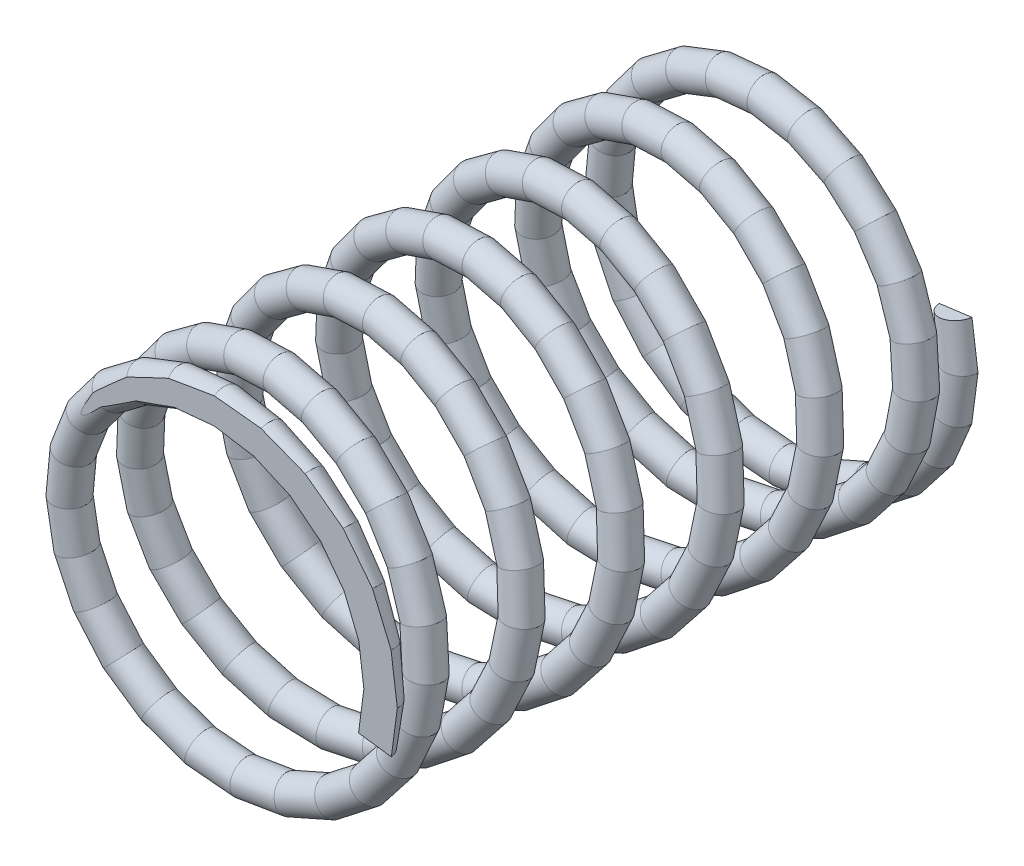
from build123d import *

# Parameters (mm, degrees)
SWEEP_4_PROFILE_R   = 2
SKETCH_8_W          = 100
SKETCH_8_H          = 100
CUT_EXTRUDE_3_DEPTH = 10
SKETCH_9_W          = 100
SKETCH_9_H          = 100
CUT_EXTRUDE_4_DEPTH = 10


with BuildPart() as part:
    # 扫描4: sweep along a curve in space
    with BuildLine() as sweep_4_path:
        Line((19.3185, 5.1764, -0.2083), (20, 0, 0))
        Line((20, 0, 0), (19.3185, -5.1764, 0.2083))
        Line((19.3185, -5.1764, 0.2083), (17.3205, -10, 0.4167))
        Line((17.3205, -10, 0.4167), (14.1421, -14.1421, 0.625))
        Line((14.1421, -14.1421, 0.625), (10, -17.3205, 0.8333))
        Line((10, -17.3205, 0.8333), (5.1764, -19.3185, 1.0417))
        Line((5.1764, -19.3185, 1.0417), (0, -20, 1.25))
        Line((0, -20, 1.25), (-5.1764, -19.3185, 1.4583))
        Line((-5.1764, -19.3185, 1.4583), (-10, -17.3205, 1.6667))
        Line((-10, -17.3205, 1.6667), (-14.1421, -14.1421, 1.875))
        Line((-14.1421, -14.1421, 1.875), (-17.3205, -10, 2.0833))
        Line((-17.3205, -10, 2.0833), (-19.3185, -5.1764, 2.2917))
        Line((-19.3185, -5.1764, 2.2917), (-20, 0, 2.5))
        Line((-20, 0, 2.5), (-19.3185, 5.1764, 2.7083))
        Line((-19.3185, 5.1764, 2.7083), (-17.3205, 10, 2.9167))
        Line((-17.3205, 10, 2.9167), (-14.1421, 14.1421, 3.125))
        Line((-14.1421, 14.1421, 3.125), (-10, 17.3205, 3.3333))
        Line((-10, 17.3205, 3.3333), (-5.1764, 19.3185, 3.5417))
        Line((-5.1764, 19.3185, 3.5417), (0, 20, 3.75))
        Line((0, 20, 3.75), (5.1764, 19.3185, 3.9705))
        Line((5.1764, 19.3185, 3.9705), (10, 17.3205, 4.2153))
        Line((10, 17.3205, 4.2153), (14.1421, 14.1421, 4.4844))
        Line((14.1421, 14.1421, 4.4844), (17.3205, 10, 4.7778))
        Line((17.3205, 10, 4.7778), (19.3185, 5.1764, 5.0955))
        Line((19.3185, 5.1764, 5.0955), (20, 0, 5.4375))
        Line((20, 0, 5.4375), (19.3185, -5.1764, 5.803))
        Line((19.3185, -5.1764, 5.803), (17.3205, -10, 6.1944))
        Line((17.3205, -10, 6.1944), (14.1421, -14.1421, 6.6094))
        Line((14.1421, -14.1421, 6.6094), (10, -17.3205, 7.0486))
        Line((10, -17.3205, 7.0486), (5.1764, -19.3185, 7.5122))
        Line((5.1764, -19.3185, 7.5122), (0, -20, 8))
        Line((0, -20, 8), (-5.1764, -19.3185, 8.5))
        Line((-5.1764, -19.3185, 8.5), (-10, -17.3205, 9))
        Line((-10, -17.3205, 9), (-14.1421, -14.1421, 9.5))
        Line((-14.1421, -14.1421, 9.5), (-17.3205, -10, 10))
        Line((-17.3205, -10, 10), (-19.3185, -5.1764, 10.5))
        Line((-19.3185, -5.1764, 10.5), (-20, 0, 11))
        Line((-20, 0, 11), (-19.3185, 5.1764, 11.5))
        Line((-19.3185, 5.1764, 11.5), (-17.3205, 10, 12))
        Line((-17.3205, 10, 12), (-14.1421, 14.1421, 12.5))
        Line((-14.1421, 14.1421, 12.5), (-10, 17.3205, 13))
        Line((-10, 17.3205, 13), (-5.1764, 19.3185, 13.5))
        Line((-5.1764, 19.3185, 13.5), (0, 20, 14))
        Line((0, 20, 14), (5.1764, 19.3185, 14.5))
        Line((5.1764, 19.3185, 14.5), (10, 17.3205, 15))
        Line((10, 17.3205, 15), (14.1421, 14.1421, 15.5))
        Line((14.1421, 14.1421, 15.5), (17.3205, 10, 16))
        Line((17.3205, 10, 16), (19.3185, 5.1764, 16.5))
        Line((19.3185, 5.1764, 16.5), (20, 0, 17))
        Line((20, 0, 17), (19.3185, -5.1764, 17.5))
        Line((19.3185, -5.1764, 17.5), (17.3205, -10, 18))
        Line((17.3205, -10, 18), (14.1421, -14.1421, 18.5))
        Line((14.1421, -14.1421, 18.5), (10, -17.3205, 19))
        Line((10, -17.3205, 19), (5.1764, -19.3185, 19.5))
        Line((5.1764, -19.3185, 19.5), (0, -20, 20))
        Line((0, -20, 20), (-5.1764, -19.3185, 20.5))
        Line((-5.1764, -19.3185, 20.5), (-10, -17.3205, 21))
        Line((-10, -17.3205, 21), (-14.1421, -14.1421, 21.5))
        Line((-14.1421, -14.1421, 21.5), (-17.3205, -10, 22))
        Line((-17.3205, -10, 22), (-19.3185, -5.1764, 22.5))
        Line((-19.3185, -5.1764, 22.5), (-20, 0, 23))
        Line((-20, 0, 23), (-19.3185, 5.1764, 23.5))
        Line((-19.3185, 5.1764, 23.5), (-17.3205, 10, 24))
        Line((-17.3205, 10, 24), (-14.1421, 14.1421, 24.5))
        Line((-14.1421, 14.1421, 24.5), (-10, 17.3205, 25))
        Line((-10, 17.3205, 25), (-5.1764, 19.3185, 25.5))
        Line((-5.1764, 19.3185, 25.5), (0, 20, 26))
        Line((0, 20, 26), (5.1764, 19.3185, 26.5))
        Line((5.1764, 19.3185, 26.5), (10, 17.3205, 27))
        Line((10, 17.3205, 27), (14.1421, 14.1421, 27.5))
        Line((14.1421, 14.1421, 27.5), (17.3205, 10, 28))
        Line((17.3205, 10, 28), (19.3185, 5.1764, 28.5))
        Line((19.3185, 5.1764, 28.5), (20, 0, 29))
        Line((20, 0, 29), (19.3185, -5.1764, 29.5))
        Line((19.3185, -5.1764, 29.5), (17.3205, -10, 30))
        Line((17.3205, -10, 30), (14.1421, -14.1421, 30.5))
        Line((14.1421, -14.1421, 30.5), (10, -17.3205, 31))
        Line((10, -17.3205, 31), (5.1764, -19.3185, 31.5))
        Line((5.1764, -19.3185, 31.5), (0, -20, 32))
        Line((0, -20, 32), (-5.1764, -19.3185, 32.5))
        Line((-5.1764, -19.3185, 32.5), (-10, -17.3205, 33))
        Line((-10, -17.3205, 33), (-14.1421, -14.1421, 33.5))
        Line((-14.1421, -14.1421, 33.5), (-17.3205, -10, 34))
        Line((-17.3205, -10, 34), (-19.3185, -5.1764, 34.5))
        Line((-19.3185, -5.1764, 34.5), (-20, 0, 35))
        Line((-20, 0, 35), (-19.3185, 5.1764, 35.5))
        Line((-19.3185, 5.1764, 35.5), (-17.3205, 10, 36))
        Line((-17.3205, 10, 36), (-14.1421, 14.1421, 36.5))
        Line((-14.1421, 14.1421, 36.5), (-10, 17.3205, 37))
        Line((-10, 17.3205, 37), (-5.1764, 19.3185, 37.5))
        Line((-5.1764, 19.3185, 37.5), (0, 20, 38))
        Line((0, 20, 38), (5.1764, 19.3185, 38.5))
        Line((5.1764, 19.3185, 38.5), (10, 17.3205, 39))
        Line((10, 17.3205, 39), (14.1421, 14.1421, 39.5))
        Line((14.1421, 14.1421, 39.5), (17.3205, 10, 40))
        Line((17.3205, 10, 40), (19.3185, 5.1764, 40.5))
        Line((19.3185, 5.1764, 40.5), (20, 0, 41))
        Line((20, 0, 41), (19.3185, -5.1764, 41.5))
        Line((19.3185, -5.1764, 41.5), (17.3205, -10, 42))
        Line((17.3205, -10, 42), (14.1421, -14.1421, 42.5))
        Line((14.1421, -14.1421, 42.5), (10, -17.3205, 43))
        Line((10, -17.3205, 43), (5.1764, -19.3185, 43.5))
        Line((5.1764, -19.3185, 43.5), (0, -20, 44))
        Line((0, -20, 44), (-5.1764, -19.3185, 44.5))
        Line((-5.1764, -19.3185, 44.5), (-10, -17.3205, 45))
        Line((-10, -17.3205, 45), (-14.1421, -14.1421, 45.5))
        Line((-14.1421, -14.1421, 45.5), (-17.3205, -10, 46))
        Line((-17.3205, -10, 46), (-19.3185, -5.1764, 46.5))
        Line((-19.3185, -5.1764, 46.5), (-20, 0, 47))
        Line((-20, 0, 47), (-19.3185, 5.1764, 47.5))
        Line((-19.3185, 5.1764, 47.5), (-17.3205, 10, 48))
        Line((-17.3205, 10, 48), (-14.1421, 14.1421, 48.5))
        Line((-14.1421, 14.1421, 48.5), (-10, 17.3205, 49))
        Line((-10, 17.3205, 49), (-5.1764, 19.3185, 49.5))
        Line((-5.1764, 19.3185, 49.5), (0, 20, 50))
        Line((0, 20, 50), (5.1764, 19.3185, 50.5))
        Line((5.1764, 19.3185, 50.5), (10, 17.3205, 51))
        Line((10, 17.3205, 51), (14.1421, 14.1421, 51.5))
        Line((14.1421, 14.1421, 51.5), (17.3205, 10, 52))
        Line((17.3205, 10, 52), (19.3185, 5.1764, 52.5))
        Line((19.3185, 5.1764, 52.5), (20, 0, 53))
        Line((20, 0, 53), (19.3185, -5.1764, 53.5))
        Line((19.3185, -5.1764, 53.5), (17.3205, -10, 54))
        Line((17.3205, -10, 54), (14.1421, -14.1421, 54.5))
        Line((14.1421, -14.1421, 54.5), (10, -17.3205, 55))
        Line((10, -17.3205, 55), (5.1764, -19.3185, 55.5))
        Line((5.1764, -19.3185, 55.5), (0, -20, 56))
        Line((0, -20, 56), (-5.1764, -19.3185, 56.5))
        Line((-5.1764, -19.3185, 56.5), (-10, -17.3205, 57))
        Line((-10, -17.3205, 57), (-14.1421, -14.1421, 57.5))
        Line((-14.1421, -14.1421, 57.5), (-17.3205, -10, 58))
        Line((-17.3205, -10, 58), (-19.3185, -5.1764, 58.5))
        Line((-19.3185, -5.1764, 58.5), (-20, 0, 59))
        Line((-20, 0, 59), (-19.3185, 5.1764, 59.5))
        Line((-19.3185, 5.1764, 59.5), (-17.3205, 10, 60))
        Line((-17.3205, 10, 60), (-14.1421, 14.1421, 60.5))
        Line((-14.1421, 14.1421, 60.5), (-10, 17.3205, 61))
        Line((-10, 17.3205, 61), (-5.1764, 19.3185, 61.5))
        Line((-5.1764, 19.3185, 61.5), (0, 20, 62))
        Line((0, 20, 62), (5.1764, 19.3185, 62.4878))
        Line((5.1764, 19.3185, 62.4878), (10, 17.3205, 62.9514))
        Line((10, 17.3205, 62.9514), (14.1421, 14.1421, 63.3906))
        Line((14.1421, 14.1421, 63.3906), (17.3205, 10, 63.8056))
        Line((17.3205, 10, 63.8056), (19.3185, 5.1764, 64.1962))
        Line((19.3185, 5.1764, 64.1962), (20, 0, 64.5625))
        Line((20, 0, 64.5625), (19.3185, -5.1764, 64.9045))
        Line((19.3185, -5.1764, 64.9045), (17.3205, -10, 65.2222))
        Line((17.3205, -10, 65.2222), (14.1421, -14.1421, 65.5156))
        Line((14.1421, -14.1421, 65.5156), (10, -17.3205, 65.7847))
        Line((10, -17.3205, 65.7847), (5.1764, -19.3185, 66.0295))
        Line((5.1764, -19.3185, 66.0295), (0, -20, 66.25))
        Line((0, -20, 66.25), (-5.1764, -19.3185, 66.4583))
        Line((-5.1764, -19.3185, 66.4583), (-10, -17.3205, 66.6667))
        Line((-10, -17.3205, 66.6667), (-14.1421, -14.1421, 66.875))
        Line((-14.1421, -14.1421, 66.875), (-17.3205, -10, 67.0833))
        Line((-17.3205, -10, 67.0833), (-19.3185, -5.1764, 67.2917))
        Line((-19.3185, -5.1764, 67.2917), (-20, 0, 67.5))
        Line((-20, 0, 67.5), (-19.3185, 5.1764, 67.7083))
        Line((-19.3185, 5.1764, 67.7083), (-17.3205, 10, 67.9167))
        Line((-17.3205, 10, 67.9167), (-14.1421, 14.1421, 68.125))
        Line((-14.1421, 14.1421, 68.125), (-10, 17.3205, 68.3333))
        Line((-10, 17.3205, 68.3333), (-5.1764, 19.3185, 68.5417))
        Line((-5.1764, 19.3185, 68.5417), (0, 20, 68.75))
        Line((0, 20, 68.75), (5.1764, 19.3185, 68.9583))
        Line((5.1764, 19.3185, 68.9583), (10, 17.3205, 69.1667))
        Line((10, 17.3205, 69.1667), (14.1421, 14.1421, 69.375))
        Line((14.1421, 14.1421, 69.375), (17.3205, 10, 69.5833))
        Line((17.3205, 10, 69.5833), (19.3185, 5.1764, 69.7917))
        Line((19.3185, 5.1764, 69.7917), (20, 0, 70))
        Line((20, 0, 70), (19.3185, -5.1764, 70.2083))
    # 扫描4 profile (on start of the path) → 扫描4 (sweep)
    with BuildSketch(Plane(origin=(19.3185, 5.1764, -0.2083), x_dir=(-0.9914445140812447, -0.13052883014186853, 0), z_dir=(0.1304250729783348, -0.9906564163830556, 0.03986433265060476))):
        Circle(SWEEP_4_PROFILE_R)
    sweep(path=sweep_4_path.line, transition=Transition.RIGHT)

    # 草图8 → 切除-拉伸3 (cut)
    with BuildSketch(Plane.XY):
        Rectangle(SKETCH_8_W, SKETCH_8_H)
    extrude(amount=-CUT_EXTRUDE_3_DEPTH, mode=Mode.SUBTRACT)

    # 草图9 → 切除-拉伸4 (cut)
    with BuildSketch(Plane.XY.offset(70)):
        Rectangle(SKETCH_9_W, SKETCH_9_H)
    extrude(amount=CUT_EXTRUDE_4_DEPTH, mode=Mode.SUBTRACT)


solid = part.part
